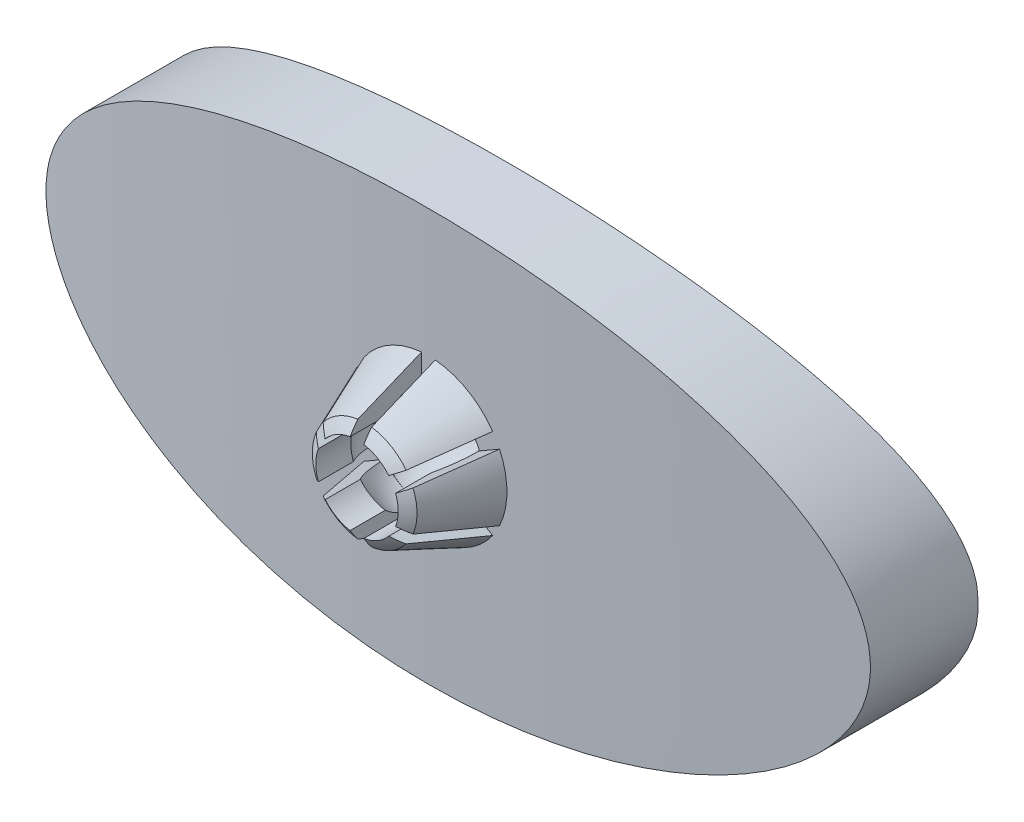
from build123d import *

# Parameters (mm, degrees)
ESQUISSE1_RX                 = 30
ESQUISSE1_RY                 = 15
BOSS_EXTRU_1_DEPTH           = 10
ENL_V_MAT_EXTRU_1_DEPTH      = 66.469493052
ENL_V_MAT_EXTRU_1_DEPTH_BACK = 66.469493052
ESQUISSE2_W                  = 135.829258556
ESQUISSE2_H                  = 49.137199478
R_VOLUTION4_ANGLE            = 180
ESQUISSE4_R                  = 3
ENL_V_MAT_EXTRU_2_DEPTH      = 10
ENL_V_MAT_EXTRU_3_DEPTH      = 10


with BuildPart() as part:
    # Esquisse1 → Boss.-Extru.1 (new body)
    with BuildSketch(Plane.XY):
        with Locations(Location((-32.93849792, 0), (0, 0, -180))):
            Ellipse(ESQUISSE1_RX, ESQUISSE1_RY)
    extrude(amount=BOSS_EXTRU_1_DEPTH)

    # Esquisse2 → Enlèv. mat.-Extru.1 (cut, two sides: drawn at the far end of the back side and taken through both)
    with BuildSketch(Plane(origin=(0, 0, 0), x_dir=(1, 0, 0), z_dir=(0, 1, 0)).offset(-ENL_V_MAT_EXTRU_1_DEPTH_BACK)):
        with Locations((-27.18359273, 1.116194727)):
            Rectangle(ESQUISSE2_W, ESQUISSE2_H)
        with BuildLine():
            Line((-64.571271969, 0.648092925), (-64.571271969, -7.564815996))
            add(Edge.make_bspline(
                [(-64.571271969, -7.564815996), (-32.960330595, -12.920208574), (-1.336024868, -7.56994592)],
                knots=[4.125834417, 4.125834417, 4.125834417, 5.298307081, 5.298307081, 5.298307081], degree=2, weights=[1, 0.833028747, 1]))
            Line((-1.336024868, -7.56994592), (-1.336024868, 0.63620889))
            add(Edge.make_bspline(
                [(-64.571271969, 0.648092925), (-32.974701148, -11.758264246), (-1.336024868, 0.63620889)],
                knots=[3.844545212, 3.844545212, 3.844545212, 5.579103035, 5.579103035, 5.579103035], degree=2, weights=[1, 0.646903964, 1]))
        make_face(mode=Mode.SUBTRACT)
    extrude(amount=ENL_V_MAT_EXTRU_1_DEPTH + ENL_V_MAT_EXTRU_1_DEPTH_BACK, mode=Mode.SUBTRACT)

    # Esquisse7 → Enlèvement de matière-Révolution1 (revolve, cut)
    with BuildSketch(Plane(origin=(0, 0, 0), x_dir=(1, 0, 0), z_dir=(0, 1, 0))):
        with BuildLine():
            Line((-32.93849792, -6), (-32.93849792, -14))
            ThreePointArc((-32.93849792, -14), (-36.93849792, -10), (-32.93849792, -6))
        make_face()
    revolve(axis=Axis((-32.93849792, 0, 6), (0, 0, 1)), mode=Mode.SUBTRACT)


with BuildPart() as body_2:
    # Esquisse3 → Révolution4 (revolve)
    with BuildSketch(Plane.XY.offset(10)):
        with BuildLine():
            Line((-32.93849792, 6), (-32.93849792, 4))
            ThreePointArc((-32.93849792, 4), (-36.93849792, 0), (-32.93849792, -4))
            Line((-32.93849792, -4), (-32.93849792, -6))
            ThreePointArc((-32.93849792, -6), (-38.93849792, 0), (-32.93849792, 6))
        make_face()
    revolve(axis=Axis((-32.93849792, 15, 10), (0, 1, 0)), revolution_arc=R_VOLUTION4_ANGLE)

    # Esquisse4 → Enlèv. mat.-Extru.2 (cut)
    with BuildSketch(Plane.XY.offset(10)):
        with Locations(Location((-32.93849792, 0, 0), (0, 0, 180))):
            Circle(ESQUISSE4_R)
    extrude(amount=ENL_V_MAT_EXTRU_2_DEPTH, mode=Mode.SUBTRACT)

    # Esquisse6 → Enlèv. mat.-Extru.3 (cut)
    with BuildSketch(Plane.XY.offset(10)):
        Polygon((-33.43849792, 6), (-32.43849792, 6), (-32.43849792, 0.866025404), (-26.333280578, 4.39087428), (-25.833280578, 3.524848876), (-31.93849792, 0), (-25.943228753, -3.461370267), (-26.443228753, -4.327395671), (-32.43849792, -0.866025404), (-32.43849792, -7.700051878), (-33.43849792, -7.700051878), (-33.43849792, -0.866025404), (-39.591228699, -4.418306175), (-40.091228699, -3.552280771), (-33.93849792, 0), (-39.130997911, 2.997891267), (-38.630997911, 3.863916671), (-33.43849792, 0.866025404), align=None)
    extrude(amount=ENL_V_MAT_EXTRU_3_DEPTH, mode=Mode.SUBTRACT)


with BuildPart() as enl_v_mat_extru_3_piece_1:
    # of the separate pieces the step leaves, piece 1, a body of its own (enl_v_mat_extru_3_pieces)
    add(body_2.part.solids().sort_by_distance((-36.125429692, -2.417326185, 10))[0])


with BuildPart() as enl_v_mat_extru_3_piece_2:
    # of the separate pieces the step leaves, piece 2, a body of its own (enl_v_mat_extru_3_pieces)
    add(body_2.part.solids().sort_by_distance((-29.751566149, -2.417326185, 10))[0])


with BuildPart() as enl_v_mat_extru_3_piece_3:
    # of the separate pieces the step leaves, piece 3, a body of its own (enl_v_mat_extru_3_pieces)
    add(body_2.part.solids().sort_by_distance((-29.251566149, 1.551300781, 10))[0])


with BuildPart() as enl_v_mat_extru_3_piece_4:
    # of the separate pieces the step leaves, piece 4, a body of its own (enl_v_mat_extru_3_pieces)
    add(body_2.part.solids().sort_by_distance((-36.625429692, 1.551300781, 10))[0])


with BuildPart() as enl_v_mat_extru_3_piece_5:
    # of the separate pieces the step leaves, piece 5, a body of its own (enl_v_mat_extru_3_pieces)
    add(body_2.part.solids().sort_by_distance((-32.43849792, 3.968626967, 10))[0])


with BuildPart() as enl_v_mat_extru_3_piece_6:
    # of the separate pieces the step leaves, piece 6, a body of its own (enl_v_mat_extru_3_pieces)
    add(body_2.part.solids().sort_by_distance((-33.43849792, 3.968626967, 10))[0])


with BuildPart() as enl_vement_de_mati_re_r_volution2_tool:
    # Esquisse8 → Enlèvement de matière-Révolution2 (revolve)
    with BuildSketch(Plane(origin=(0, 0, 0), x_dir=(1, 0, 0), z_dir=(0, 1, 0))):
        Polygon((-42.945095718, -10), (-38.652537318, -10), (-35.810659388, -16.913614243), (-42.945095718, -16.913614243), align=None)
    revolve(axis=Axis((-32.93849792, 0, 10), (0, 0, 1)))


with BuildPart() as enl_v_mat_extru_3_piece_1_1:
    add(enl_v_mat_extru_3_piece_1.part)

    # Enlèvement de matière-Révolution2: cut by enl_vement_de_mati_re_r_volution2_tool
    add(enl_vement_de_mati_re_r_volution2_tool.part, mode=Mode.SUBTRACT)


with BuildPart() as enl_v_mat_extru_3_piece_2_1:
    add(enl_v_mat_extru_3_piece_2.part)

    # Enlèvement de matière-Révolution2: cut by enl_vement_de_mati_re_r_volution2_tool
    add(enl_vement_de_mati_re_r_volution2_tool.part, mode=Mode.SUBTRACT)


with BuildPart() as enl_v_mat_extru_3_piece_3_1:
    add(enl_v_mat_extru_3_piece_3.part)

    # Enlèvement de matière-Révolution2: cut by enl_vement_de_mati_re_r_volution2_tool
    add(enl_vement_de_mati_re_r_volution2_tool.part, mode=Mode.SUBTRACT)


with BuildPart() as enl_v_mat_extru_3_piece_4_1:
    add(enl_v_mat_extru_3_piece_4.part)

    # Enlèvement de matière-Révolution2: cut by enl_vement_de_mati_re_r_volution2_tool
    add(enl_vement_de_mati_re_r_volution2_tool.part, mode=Mode.SUBTRACT)


with BuildPart() as enl_v_mat_extru_3_piece_5_1:
    add(enl_v_mat_extru_3_piece_5.part)

    # Enlèvement de matière-Révolution2: cut by enl_vement_de_mati_re_r_volution2_tool
    add(enl_vement_de_mati_re_r_volution2_tool.part, mode=Mode.SUBTRACT)


with BuildPart() as enl_v_mat_extru_3_piece_6_1:
    add(enl_v_mat_extru_3_piece_6.part)

    # Enlèvement de matière-Révolution2: cut by enl_vement_de_mati_re_r_volution2_tool
    add(enl_vement_de_mati_re_r_volution2_tool.part, mode=Mode.SUBTRACT)


solid = Compound([part.part, enl_v_mat_extru_3_piece_1_1.part, enl_v_mat_extru_3_piece_2_1.part, enl_v_mat_extru_3_piece_3_1.part, enl_v_mat_extru_3_piece_4_1.part, enl_v_mat_extru_3_piece_5_1.part, enl_v_mat_extru_3_piece_6_1.part])
